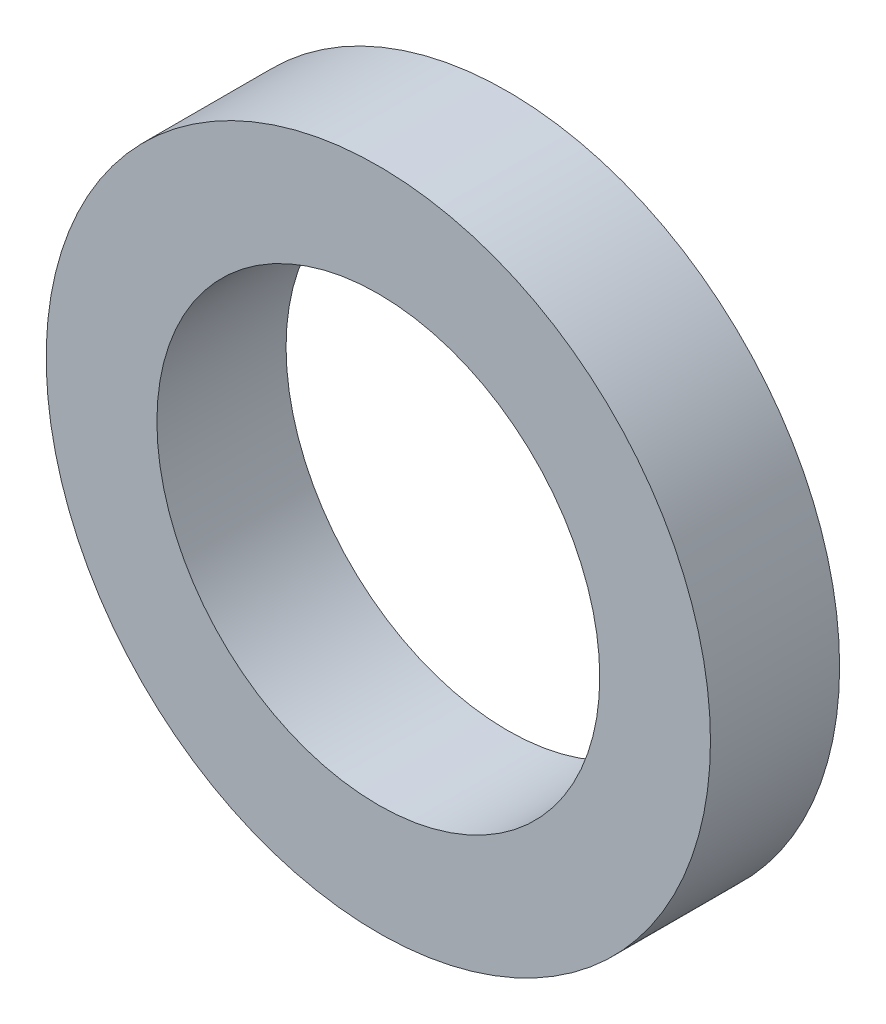
from build123d import *

# Parameters (mm, degrees)
UPPER_START                        = 58
SKETCH1_R                          = 18
SKETCH1_R_2                        = 12
UPPER_SLEEVE_24_ID_AND_36_OD_DEPTH = 7


with BuildPart() as part:
    # Sketch1 → Upper sleeve - 24 ID and 36 OD (new body)
    with BuildSketch(Plane.XY.offset(UPPER_START)):
        Circle(SKETCH1_R)
        Circle(SKETCH1_R_2, mode=Mode.SUBTRACT)
    extrude(amount=UPPER_SLEEVE_24_ID_AND_36_OD_DEPTH)


solid = part.part
